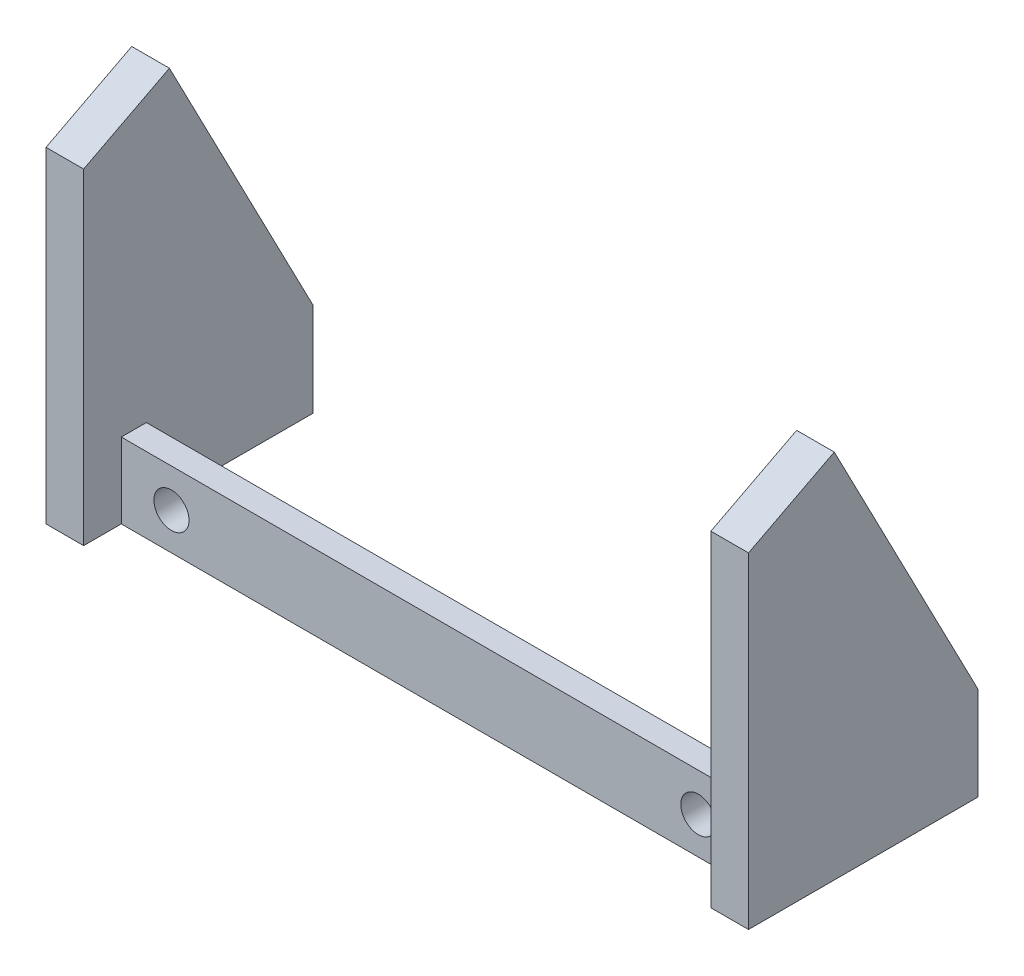
from build123d import *

# Parameters (mm, degrees)
EXTRUDE_1_DEPTH     = 3
EXTRUDE_2_DEPTH     = 3
EXTRUDE_3_REACH     = 113.195
SKETCH_5_W          = 2
SKETCH_5_H          = 6
CUT_EXTRUDE_1_REACH = 101.791
SKETCH_8_R          = 1.4


with BuildPart() as part:
    # 草图2 → 凸台-拉伸1 (new body)
    with BuildSketch(Plane(origin=(0, 0, 0), x_dir=(0, 0, -1), z_dir=(1, 0, 0))):
        Polygon((-47.106132348, 81.520542784), (-35.64838785, 59.42240106), (-35.64838785, 51.976234999), (-53.941911918, 51.976234999), (-53.941911918, 77.976234999), align=None)
    extrude(amount=EXTRUDE_1_DEPTH)


with BuildPart() as body_2:
    # 草图3 → 凸台-拉伸2 (new body)
    with BuildSketch(Plane(origin=(53, 0, 0), x_dir=(0, 0, -1), z_dir=(1, 0, 0))):
        Polygon((-47.106132348, 81.520542784), (-53.941911918, 77.976234999), (-53.941911918, 51.976234999), (-35.64838785, 51.976234999), (-35.64838785, 59.42240106), align=None)
    extrude(amount=EXTRUDE_2_DEPTH)

    # 草图5 → 凸台-拉伸3 (add, up to next)
    with BuildSketch(Plane(origin=(3, 0, 0), x_dir=(0, 0, -1), z_dir=(1, 0, 0)), mode=Mode.PRIVATE) as extrude_3_sk1:
        with Locations((-49.941911918, 54.976234999)):
            Rectangle(SKETCH_5_W, SKETCH_5_H)
    extrude_3_tool1 = extrude(extrude_3_sk1.sketch, amount=EXTRUDE_3_REACH, mode=Mode.PRIVATE) - body_2.part

    add(part.part)  # 凸台-拉伸3 merges part
    add(extrude_3_tool1.solids().sort_by_distance((3, 54.976235, 49.941912))[0])

    # 草图8 → 切除-拉伸1 (cut, up to next)
    with BuildSketch(Plane(origin=(0, 0, 48.941911918), x_dir=(-1, 0, 0), z_dir=(0, 0, -1)), mode=Mode.PRIVATE) as cut_extrude_1_sk1:
        with Locations((-49, 54.923853845)):
            Circle(SKETCH_8_R)
    cut_extrude_1_tool1 = extrude(cut_extrude_1_sk1.sketch, amount=-CUT_EXTRUDE_1_REACH, mode=Mode.PRIVATE) & body_2.part
    # 草图8 → 切除-拉伸1 (cut, up to next)
    with BuildSketch(Plane(origin=(0, 0, 48.941911918), x_dir=(-1, 0, 0), z_dir=(0, 0, -1)), mode=Mode.PRIVATE) as cut_extrude_1_sk2:
        with Locations((-7, 54.923853845)):
            Circle(SKETCH_8_R)
    cut_extrude_1_tool2 = extrude(cut_extrude_1_sk2.sketch, amount=-CUT_EXTRUDE_1_REACH, mode=Mode.PRIVATE) & body_2.part
    add(cut_extrude_1_tool1.solids().sort_by_distance((49, 54.923854, 48.941912))[0], mode=Mode.SUBTRACT)
    add(cut_extrude_1_tool2.solids().sort_by_distance((7, 54.923854, 48.941912))[0], mode=Mode.SUBTRACT)


solid = body_2.part
